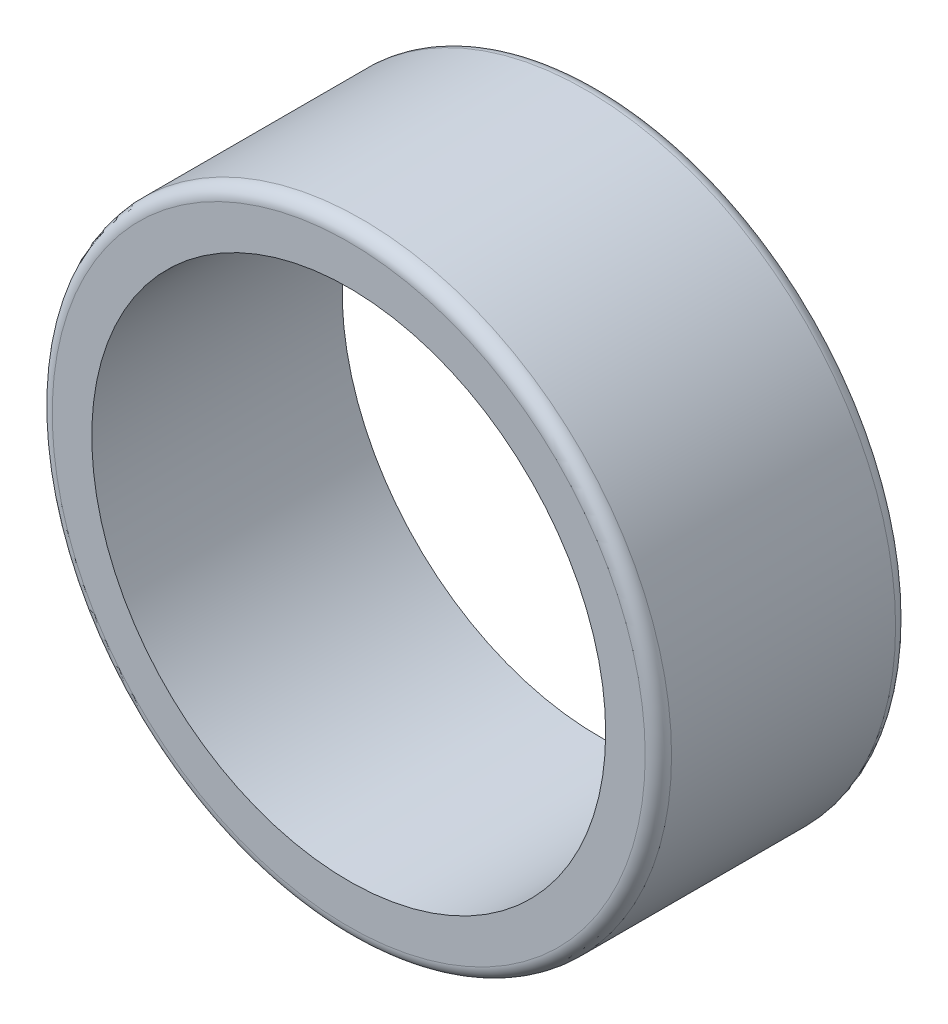
from build123d import *

# Parameters (mm, degrees)
SKETCH_1_R      = 11.75
SKETCH_1_R_2    = 9.75
EXTRUDE_1_DEPTH = 9.5
FILLET_1_R      = 0.5
FILLET_2_R      = 0.5


with BuildPart() as part:
    # 스케치1 → 돌출1 (new body)
    with BuildSketch(Plane.XY):
        Circle(SKETCH_1_R)
        Circle(SKETCH_1_R_2, mode=Mode.SUBTRACT)
    extrude(amount=EXTRUDE_1_DEPTH)

    # 필렛1
    fillet_1_edges = [part.edges().sort_by_distance(p)[0] for p in [
        (-11.75, 0, 9.5),
    ]]
    fillet(fillet_1_edges, radius=FILLET_1_R)

    # 필렛2
    fillet_2_edges = [part.edges().sort_by_distance(p)[0] for p in [
        (-11.75, 0, 0),
    ]]
    fillet(fillet_2_edges, radius=FILLET_2_R)


solid = part.part
